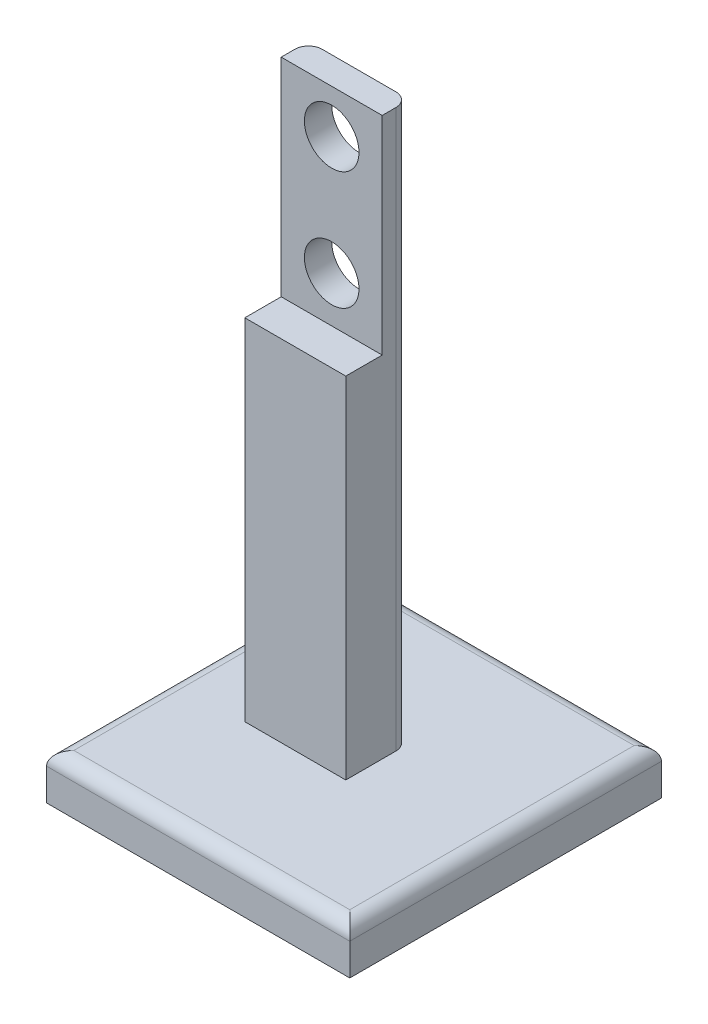
from build123d import *

# Parameters (mm, degrees)
SKETCH2_W           = 11.098911764
SKETCH2_H           = 22.811533966
BOSS_EXTRUDE1_DEPTH = 3
SKETCH3_R           = 3
CUT_EXTRUDE1_DEPTH  = 3
SKETCH4_R           = 3
CUT_EXTRUDE2_DEPTH  = 3
SKETCH5_W           = 11.098911764
SKETCH5_H           = 43.450096688
BOSS_EXTRUDE2_DEPTH = 7
SKETCH6_W           = 33.326148871
SKETCH6_H           = 34.2553563
BOSS_EXTRUDE3_DEPTH = 5
FILLET1_R           = 1.5
FILLET2_R           = 1.5


with BuildPart() as part:
    # Sketch2 → Boss-Extrude1 (new body)
    with BuildSketch(Plane.XY):
        Rectangle(SKETCH2_W, SKETCH2_H)
    extrude(amount=BOSS_EXTRUDE1_DEPTH)

    # Sketch3 → Cut-Extrude1 (cut)
    with BuildSketch(Plane(origin=(0, 0, 0), x_dir=(-1, 0, 0), z_dir=(0, 0, -1))):
        with Locations((0, 6.609786308)):
            Circle(SKETCH3_R)
    extrude(amount=-CUT_EXTRUDE1_DEPTH, mode=Mode.SUBTRACT)

    # Sketch4 → Cut-Extrude2 (cut)
    with BuildSketch(Plane(origin=(0, 0, 0), x_dir=(-1, 0, 0), z_dir=(0, 0, -1))):
        with Locations((0, -6.390213692)):
            Circle(SKETCH4_R)
    extrude(amount=-CUT_EXTRUDE2_DEPTH, mode=Mode.SUBTRACT)

    # Sketch5 → Boss-Extrude2 (add)
    with BuildSketch(Plane(origin=(0, 0, 0), x_dir=(-1, 0, 0), z_dir=(0, 0, -1))):
        with Locations((0, -33.130815327)):
            Rectangle(SKETCH5_W, SKETCH5_H)
    extrude(amount=-BOSS_EXTRUDE2_DEPTH)

    # Sketch6 → Boss-Extrude3 (add)
    with BuildSketch(Plane(origin=(0, -54.855863671, 0), x_dir=(-1, 0, 0), z_dir=(0, -1, 0))):
        with Locations((-2.951768269, -3.500092928)):
            Rectangle(SKETCH6_W, SKETCH6_H)
    extrude(amount=-BOSS_EXTRUDE3_DEPTH)

    # Fillet1
    fillet1_edges = [part.edges().sort_by_distance(p)[0] for p in [
        (-13.711306166, -49.855863671, 3.500092928),
        (2.951768269, -49.855863671, 20.627771078),
        (19.614842705, -49.855863671, 3.500092928),
        (2.951768269, -49.855863671, -13.627585222),
    ]]
    fillet(fillet1_edges, radius=FILLET1_R)

    # Fillet2
    fillet2_edges = [part.edges().sort_by_distance(p)[0] for p in [
        (5.549455882, -19.225048344, 0),
        (-5.549455882, -19.225048344, 0),
    ]]
    fillet(fillet2_edges, radius=FILLET2_R)


solid = part.part
